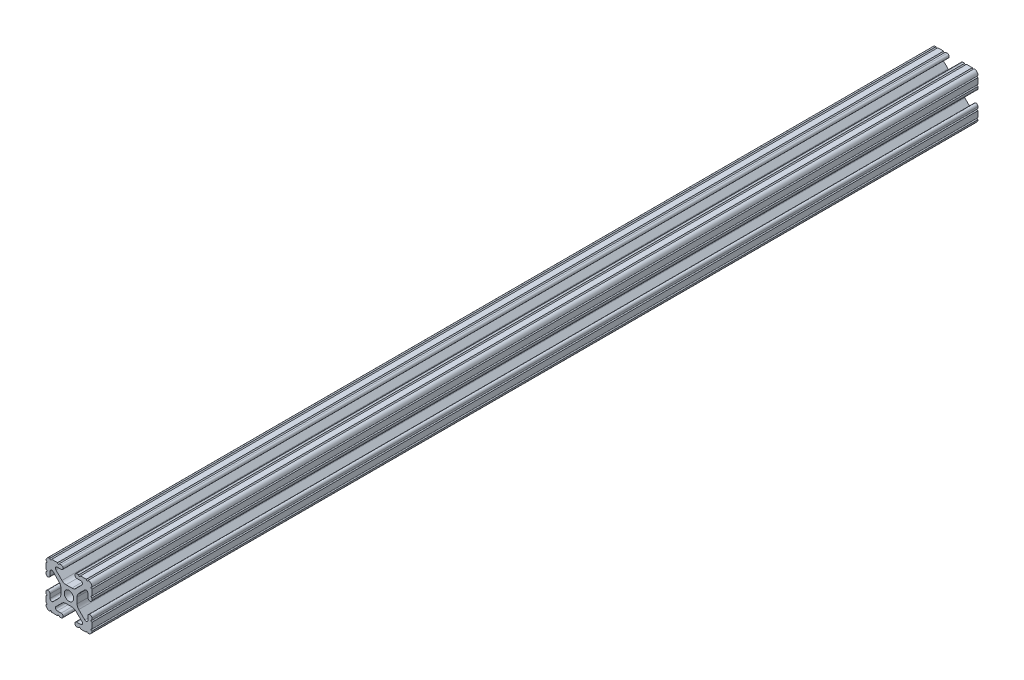
from build123d import *

# Parameters (mm, degrees)
SKETCH1_R           = 2.6035
BOSS_EXTRUDE1_DEPTH = 490.22


with BuildPart() as part:
    # Sketch1 → Boss-Extrude1 (new body)
    with BuildSketch(Plane(origin=(0, 0, -25.4), x_dir=(-1, 0, 0), z_dir=(0, 0, -1))):
        with BuildLine():
            Line((12.7, -9.5504), (12.7, -6.3330836))
            ThreePointArc((12.7, -6.3330836), (12.192, -5.8250836), (12.7, -5.3170836))
            Line((12.7, -5.3170836), (12.7, -4.3434))
            ThreePointArc((12.7, -4.3434), (11.5951, -3.2385), (10.4902, -4.3434))
            Line((10.4902, -4.3434), (10.4902, -6.474794456))
            ThreePointArc((10.4902, -6.474794456), (9.863006367, -7.413456061), (8.75577951, -7.193214945))
            Line((8.75577951, -7.193214945), (5.42573597, -3.863171405))
            ThreePointArc((5.42573597, -3.863171405), (4.737482484, -2.833127272), (4.4958, -1.618107374))
            Line((4.4958, -1.618107374), (4.4958, 1.618107374))
            ThreePointArc((4.4958, 1.618107374), (4.737482484, 2.833127272), (5.42573597, 3.863171405))
            Line((5.42573597, 3.863171405), (8.75577951, 7.193214945))
            ThreePointArc((8.75577951, 7.193214945), (9.863006367, 7.413456061), (10.4902, 6.474794456))
            Line((10.4902, 6.474794456), (10.4902, 4.343399971))
            ThreePointArc((10.4902, 4.343399971), (11.5951, 3.238499971), (12.7, 4.343399971))
            Line((12.7, 4.343399971), (12.7, 5.3170836))
            ThreePointArc((12.7, 5.3170836), (12.192, 5.8250836), (12.7, 6.3330836))
            Line((12.7, 6.3330836), (12.7, 9.5504))
            ThreePointArc((12.7, 9.5504), (12.192000006, 10.058323491), (12.699846982, 10.566399977))
            ThreePointArc((12.699846982, 10.566399977), (12.082522516, 12.082522516), (10.566399977, 12.699846982))
            ThreePointArc((10.566399977, 12.699846982), (10.058323491, 12.192000006), (9.5504, 12.7))
            Line((9.5504, 12.7), (6.3330836, 12.7))
            ThreePointArc((6.3330836, 12.7), (5.8250836, 12.192), (5.3170836, 12.7))
            Line((5.3170836, 12.7), (4.3434, 12.7))
            ThreePointArc((4.3434, 12.7), (3.2385, 11.5951), (4.3434, 10.4902))
            Line((4.3434, 10.4902), (6.474794456, 10.4902))
            ThreePointArc((6.474794456, 10.4902), (7.413456061, 9.863006367), (7.193214945, 8.75577951))
            Line((7.193214945, 8.75577951), (3.863171405, 5.42573597))
            ThreePointArc((3.863171405, 5.42573597), (2.833127272, 4.737482484), (1.618107374, 4.4958))
            Line((1.618107374, 4.4958), (-1.618107374, 4.4958))
            ThreePointArc((-1.618107374, 4.4958), (-2.833127272, 4.737482484), (-3.863171405, 5.42573597))
            Line((-3.863171405, 5.42573597), (-7.193214945, 8.75577951))
            ThreePointArc((-7.193214945, 8.75577951), (-7.413456061, 9.863006367), (-6.474794456, 10.4902))
            Line((-6.474794456, 10.4902), (-4.343399971, 10.4902))
            ThreePointArc((-4.343399971, 10.4902), (-3.238499971, 11.5951), (-4.343399971, 12.7))
            Line((-4.343399971, 12.7), (-5.3170836, 12.7))
            ThreePointArc((-5.3170836, 12.7), (-5.8250836, 12.192), (-6.3330836, 12.7))
            Line((-6.3330836, 12.7), (-9.5504, 12.7))
            ThreePointArc((-9.5504, 12.7), (-10.058323491, 12.192000006), (-10.566399977, 12.699846982))
            ThreePointArc((-10.566399977, 12.699846982), (-12.082522516, 12.082522516), (-12.699846982, 10.566399977))
            ThreePointArc((-12.699846982, 10.566399977), (-12.192000006, 10.058323491), (-12.7, 9.5504))
            Line((-12.7, 9.5504), (-12.7, 6.3330836))
            ThreePointArc((-12.7, 6.3330836), (-12.192, 5.8250836), (-12.7, 5.3170836))
            Line((-12.7, 5.3170836), (-12.7, 4.3434))
            ThreePointArc((-12.7, 4.3434), (-11.5951, 3.2385), (-10.4902, 4.3434))
            Line((-10.4902, 4.3434), (-10.4902, 6.474794456))
            ThreePointArc((-10.4902, 6.474794456), (-9.863006367, 7.413456061), (-8.75577951, 7.193214945))
            Line((-8.75577951, 7.193214945), (-5.42573597, 3.863171405))
            ThreePointArc((-5.42573597, 3.863171405), (-4.737482484, 2.833127272), (-4.4958, 1.618107374))
            Line((-4.4958, 1.618107374), (-4.4958, -1.618107374))
            ThreePointArc((-4.4958, -1.618107374), (-4.737482484, -2.833127272), (-5.42573597, -3.863171405))
            Line((-5.42573597, -3.863171405), (-8.75577951, -7.193214945))
            ThreePointArc((-8.75577951, -7.193214945), (-9.863006367, -7.413456061), (-10.4902, -6.474794456))
            Line((-10.4902, -6.474794456), (-10.4902, -4.343399971))
            ThreePointArc((-10.4902, -4.343399971), (-11.5951, -3.238499971), (-12.7, -4.343399971))
            Line((-12.7, -4.343399971), (-12.7, -5.3170836))
            ThreePointArc((-12.7, -5.3170836), (-12.192, -5.8250836), (-12.7, -6.3330836))
            Line((-12.7, -6.3330836), (-12.7, -9.5504))
            ThreePointArc((-12.7, -9.5504), (-12.192000006, -10.058323491), (-12.699846982, -10.566399977))
            ThreePointArc((-12.699846982, -10.566399977), (-12.082522516, -12.082522516), (-10.566399977, -12.699846982))
            ThreePointArc((-10.566399977, -12.699846982), (-10.058323491, -12.192000006), (-9.5504, -12.7))
            Line((-9.5504, -12.7), (-6.3330836, -12.7))
            ThreePointArc((-6.3330836, -12.7), (-5.8250836, -12.192), (-5.3170836, -12.7))
            Line((-5.3170836, -12.7), (-4.3434, -12.7))
            ThreePointArc((-4.3434, -12.7), (-3.2385, -11.5951), (-4.3434, -10.4902))
            Line((-4.3434, -10.4902), (-6.474794456, -10.4902))
            ThreePointArc((-6.474794456, -10.4902), (-7.413456061, -9.863006367), (-7.193214945, -8.75577951))
            Line((-7.193214945, -8.75577951), (-3.863171405, -5.42573597))
            ThreePointArc((-3.863171405, -5.42573597), (-2.833127272, -4.737482484), (-1.618107374, -4.4958))
            Line((-1.618107374, -4.4958), (1.618107374, -4.4958))
            ThreePointArc((1.618107374, -4.4958), (2.833127272, -4.737482484), (3.863171405, -5.42573597))
            Line((3.863171405, -5.42573597), (7.193214945, -8.75577951))
            ThreePointArc((7.193214945, -8.75577951), (7.413456061, -9.863006367), (6.474794456, -10.4902))
            Line((6.474794456, -10.4902), (4.343399971, -10.4902))
            ThreePointArc((4.343399971, -10.4902), (3.238499971, -11.5951), (4.343399971, -12.7))
            Line((4.343399971, -12.7), (5.3170836, -12.7))
            ThreePointArc((5.3170836, -12.7), (5.8250836, -12.192), (6.3330836, -12.7))
            Line((6.3330836, -12.7), (9.5504, -12.7))
            ThreePointArc((9.5504, -12.7), (10.058323491, -12.192000006), (10.566399977, -12.699846982))
            ThreePointArc((10.566399977, -12.699846982), (12.082522516, -12.082522516), (12.699846982, -10.566399977))
            ThreePointArc((12.699846982, -10.566399977), (12.192000006, -10.058323491), (12.7, -9.5504))
        make_face()
        with Locations(Location((0, 0, 0), (0, 0, 180))):
            Circle(SKETCH1_R, mode=Mode.SUBTRACT)
    extrude(amount=-BOSS_EXTRUDE1_DEPTH)


solid = part.part
